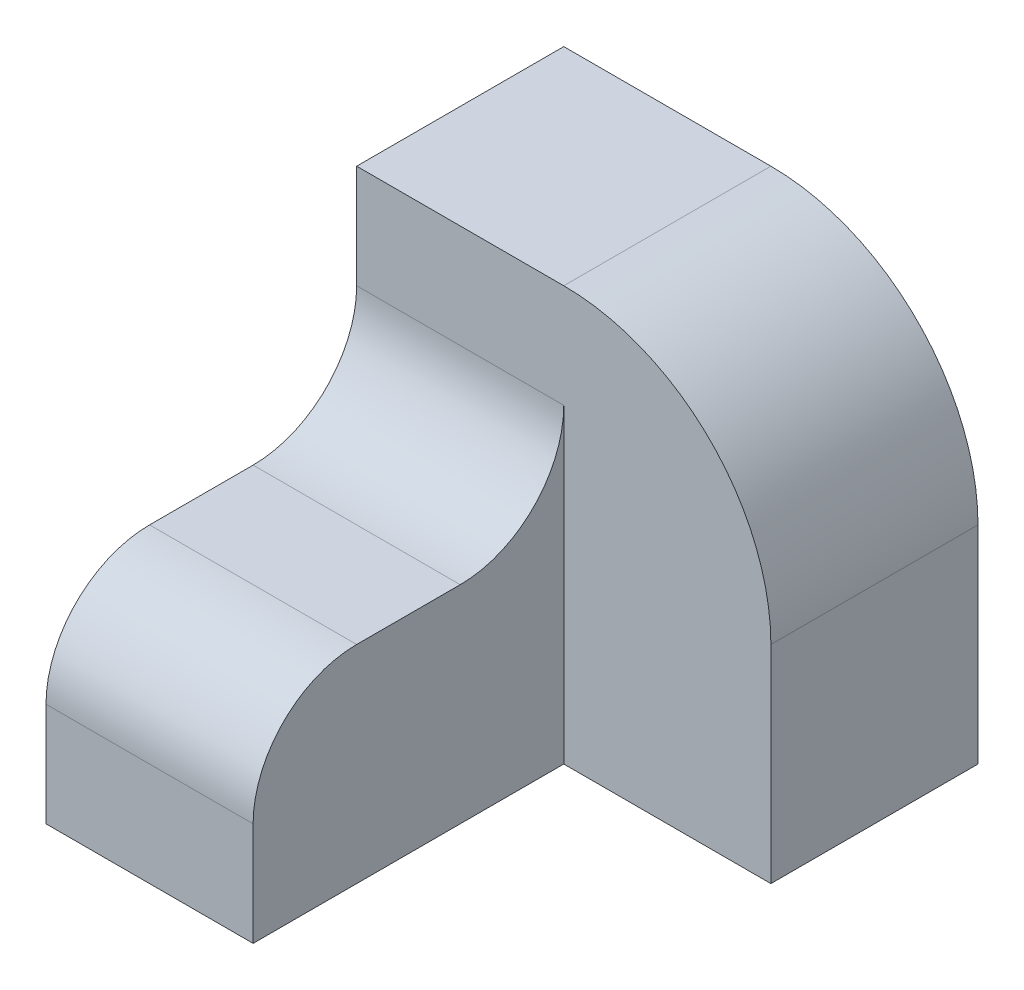
from build123d import *

# Parameters (mm, degrees)
BOSS_EXTRUDE1_DEPTH = 20
BOSS_EXTRUDE2_DEPTH = 20


with BuildPart() as part:
    # Sketch1 → Boss-Extrude1 (new body)
    with BuildSketch(Plane(origin=(0, 0, 0), x_dir=(0, 0, -1), z_dir=(1, 0, 0))):
        with BuildLine():
            Line((-10, -20), (-40, -20))
            Line((-40, -20), (-40, -10))
            ThreePointArc((-40, -10), (-37.071067812, -2.928932188), (-30, 0))
            Line((-30, 0), (-20, 0))
            ThreePointArc((-20, 0), (-12.928932188, 2.928932188), (-10, 10))
            Line((-10, 10), (-10, 20))
            Line((-10, 20), (10, 20))
            Line((10, 20), (10, -20))
            Line((10, -20), (-10, -20))
        make_face()
    extrude(amount=BOSS_EXTRUDE1_DEPTH)

    # Sketch2 → Boss-Extrude2 (add)
    with BuildSketch(Plane(origin=(0, 0, -10), x_dir=(-1, 0, 0), z_dir=(0, 0, -1))):
        with BuildLine():
            Line((-40, 0), (-40, -20))
            Line((-40, -20), (-20, -20))
            Line((-20, -20), (-20, 20))
            ThreePointArc((-20, 20), (-34.142135624, 14.142135624), (-40, 0))
        make_face()
    extrude(amount=-BOSS_EXTRUDE2_DEPTH)


solid = part.part
